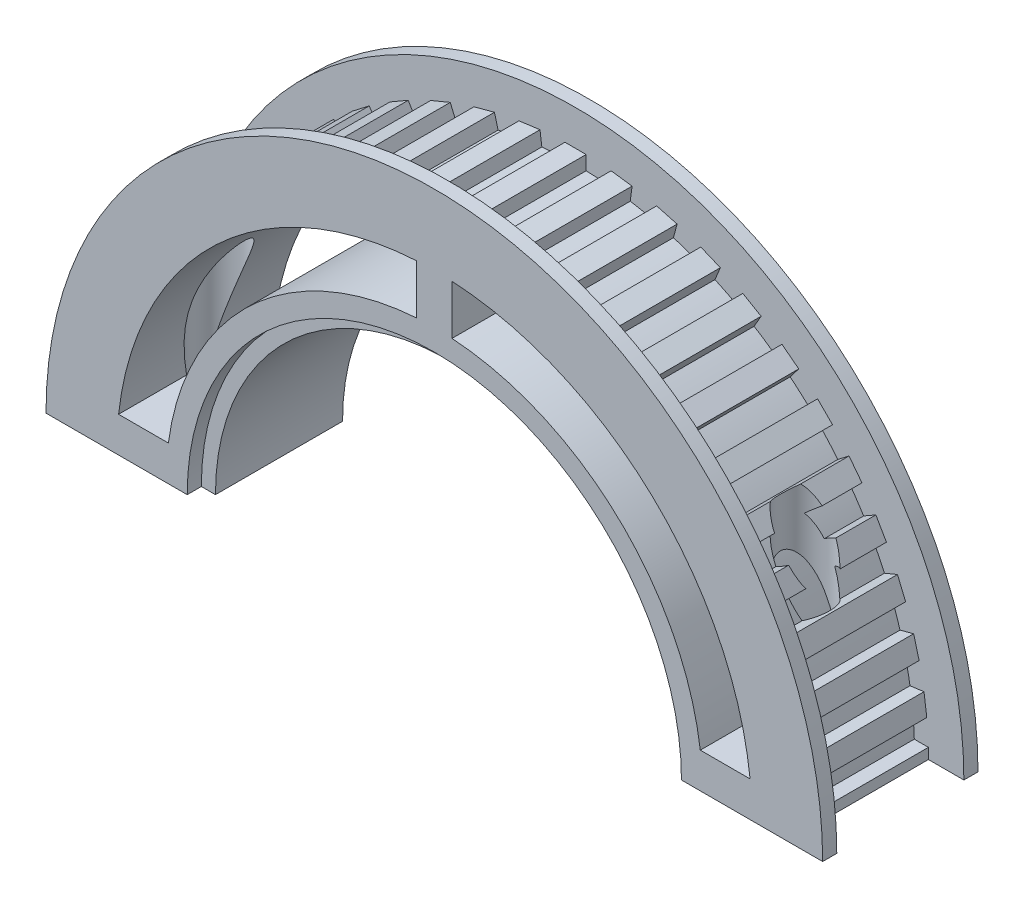
from build123d import *

# Parameters (mm, degrees)
BOSS_EXTRUDE1_DEPTH = 22
SKETCH10_R          = 1.75
CUT_EXTRUDE4_DEPTH  = 75.022378064
BOSS_EXTRUDE3_DEPTH = 2
BOSS_EXTRUDE4_START = -2
BOSS_EXTRUDE4_DEPTH = 2
BOSS_EXTRUDE5_DEPTH = 18
SKETCH11_R          = 3.5
CUT_EXTRUDE5_DEPTH  = 78.517739934
CUT_EXTRUDE6_DEPTH  = 2


with BuildPart() as part:
    # Sketch1 → Boss-Extrude1 (new body)
    with BuildSketch(Plane.XY):
        with BuildLine():
            Line((35, 0), (49.976556775, 0))
            Line((49.976556775, 0), (49.976556775, 1.5))
            Line((49.976556775, 1.5), (47.976556775, 1.5))
            ThreePointArc((47.976556775, 1.5), (47.897228315, 3.139350203), (47.761899969, 4.77502998))
            Line((47.761899969, 4.77502998), (49.744789692, 5.036082364))
            Line((49.744789692, 5.036082364), (49.353211116, 8.010416948))
            Line((49.353211116, 8.010416948), (47.370321393, 7.749364564))
            ThreePointArc((47.370321393, 7.749364564), (47.077693459, 9.364335457), (46.730023813, 10.968357872))
            Line((46.730023813, 10.968357872), (48.661875466, 11.485995963))
            Line((48.661875466, 11.485995963), (47.88541833, 14.383773441))
            Line((47.88541833, 14.383773441), (45.953566678, 13.866135351))
            ThreePointArc((45.953566678, 13.866135351), (45.452646216, 15.429094335), (44.898583993, 16.974014121))
            Line((44.898583993, 16.974014121), (46.746343059, 17.739380986))
            Line((46.746343059, 17.739380986), (45.598292761, 20.511019583))
            Line((45.598292761, 20.511019583), (43.750533696, 19.745652719))
            ThreePointArc((43.750533696, 19.745652719), (43.049891594, 21.229857131), (42.298916953, 22.689240282))
            Line((42.298916953, 22.689240282), (44.030967761, 23.689240282))
            Line((44.030967761, 23.689240282), (42.530967761, 26.287316493))
            Line((42.530967761, 26.287316493), (40.798916953, 25.287316493))
            ThreePointArc((40.798916953, 25.287316493), (39.910541391, 26.667371185), (38.975503717, 28.016247251))
            Line((38.975503717, 28.016247251), (40.562210397, 29.233770109))
            Line((40.562210397, 29.233770109), (38.73592611, 31.61383013))
            Line((38.73592611, 31.61383013), (37.14921943, 30.396307272))
            ThreePointArc((37.14921943, 30.396307272), (36.088310759, 31.648599125), (34.985208805, 32.863888462))
            Line((34.985208805, 32.863888462), (36.399422368, 34.278102024))
            Line((36.399422368, 34.278102024), (34.278102024, 36.399422368))
            Line((34.278102024, 36.399422368), (32.863888462, 34.985208805))
            ThreePointArc((32.863888462, 34.985208805), (31.648599125, 36.088310759), (30.396307272, 37.14921943))
            Line((30.396307272, 37.14921943), (31.61383013, 38.73592611))
            Line((31.61383013, 38.73592611), (29.233770109, 40.562210397))
            Line((29.233770109, 40.562210397), (28.016247251, 38.975503717))
            ThreePointArc((28.016247251, 38.975503717), (26.667371185, 39.910541391), (25.287316493, 40.798916953))
            Line((25.287316493, 40.798916953), (26.287316493, 42.530967761))
            Line((26.287316493, 42.530967761), (23.689240282, 44.030967761))
            Line((23.689240282, 44.030967761), (22.689240282, 42.298916953))
            ThreePointArc((22.689240282, 42.298916953), (21.229857131, 43.049891594), (19.745652719, 43.750533696))
            Line((19.745652719, 43.750533696), (20.511019583, 45.598292761))
            Line((20.511019583, 45.598292761), (17.739380986, 46.746343059))
            Line((17.739380986, 46.746343059), (16.974014121, 44.898583993))
            ThreePointArc((16.974014121, 44.898583993), (15.429094335, 45.452646216), (13.866135351, 45.953566678))
            Line((13.866135351, 45.953566678), (14.383773441, 47.88541833))
            Line((14.383773441, 47.88541833), (11.485995963, 48.661875466))
            Line((11.485995963, 48.661875466), (10.968357872, 46.730023813))
            ThreePointArc((10.968357872, 46.730023813), (9.364335457, 47.077693459), (7.749364564, 47.370321393))
            Line((7.749364564, 47.370321393), (8.010416948, 49.353211116))
            Line((8.010416948, 49.353211116), (5.036082364, 49.744789692))
            Line((5.036082364, 49.744789692), (4.77502998, 47.761899969))
            ThreePointArc((4.77502998, 47.761899969), (3.139350203, 47.897228315), (1.5, 47.976556775))
            Line((1.5, 47.976556775), (1.5, 49.976556775))
            Line((1.5, 49.976556775), (-1.5, 49.976556775))
            Line((-1.5, 49.976556775), (-1.5, 47.976556775))
            ThreePointArc((-1.5, 47.976556775), (-3.139350203, 47.897228315), (-4.77502998, 47.761899969))
            Line((-4.77502998, 47.761899969), (-5.036082364, 49.744789692))
            Line((-5.036082364, 49.744789692), (-8.010416948, 49.353211116))
            Line((-8.010416948, 49.353211116), (-7.749364564, 47.370321393))
            ThreePointArc((-7.749364564, 47.370321393), (-9.364335457, 47.077693459), (-10.968357872, 46.730023813))
            Line((-10.968357872, 46.730023813), (-11.485995963, 48.661875466))
            Line((-11.485995963, 48.661875466), (-14.383773441, 47.88541833))
            Line((-14.383773441, 47.88541833), (-13.866135351, 45.953566678))
            ThreePointArc((-13.866135351, 45.953566678), (-15.429094335, 45.452646216), (-16.974014121, 44.898583993))
            Line((-16.974014121, 44.898583993), (-17.739380986, 46.746343059))
            Line((-17.739380986, 46.746343059), (-20.511019583, 45.598292761))
            Line((-20.511019583, 45.598292761), (-19.745652719, 43.750533696))
            ThreePointArc((-19.745652719, 43.750533696), (-21.229857131, 43.049891594), (-22.689240282, 42.298916953))
            Line((-22.689240282, 42.298916953), (-23.689240282, 44.030967761))
            Line((-23.689240282, 44.030967761), (-26.287316493, 42.530967761))
            Line((-26.287316493, 42.530967761), (-25.287316493, 40.798916953))
            ThreePointArc((-25.287316493, 40.798916953), (-26.667371185, 39.910541391), (-28.016247251, 38.975503717))
            Line((-28.016247251, 38.975503717), (-29.233770109, 40.562210397))
            Line((-29.233770109, 40.562210397), (-31.61383013, 38.73592611))
            Line((-31.61383013, 38.73592611), (-30.396307272, 37.14921943))
            ThreePointArc((-30.396307272, 37.14921943), (-31.648599125, 36.088310759), (-32.863888462, 34.985208805))
            Line((-32.863888462, 34.985208805), (-34.278102024, 36.399422368))
            Line((-34.278102024, 36.399422368), (-36.399422368, 34.278102024))
            Line((-36.399422368, 34.278102024), (-34.985208805, 32.863888462))
            ThreePointArc((-34.985208805, 32.863888462), (-36.088310759, 31.648599125), (-37.14921943, 30.396307272))
            Line((-37.14921943, 30.396307272), (-38.73592611, 31.61383013))
            Line((-38.73592611, 31.61383013), (-40.562210397, 29.233770109))
            Line((-40.562210397, 29.233770109), (-38.975503717, 28.016247251))
            ThreePointArc((-38.975503717, 28.016247251), (-39.910541391, 26.667371185), (-40.798916953, 25.287316493))
            Line((-40.798916953, 25.287316493), (-42.530967761, 26.287316493))
            Line((-42.530967761, 26.287316493), (-44.030967761, 23.689240282))
            Line((-44.030967761, 23.689240282), (-42.298916953, 22.689240282))
            ThreePointArc((-42.298916953, 22.689240282), (-43.049891594, 21.229857131), (-43.750533696, 19.745652719))
            Line((-43.750533696, 19.745652719), (-45.598292761, 20.511019583))
            Line((-45.598292761, 20.511019583), (-46.746343059, 17.739380986))
            Line((-46.746343059, 17.739380986), (-44.898583993, 16.974014121))
            ThreePointArc((-44.898583993, 16.974014121), (-45.452646216, 15.429094335), (-45.953566678, 13.866135351))
            Line((-45.953566678, 13.866135351), (-47.88541833, 14.383773441))
            Line((-47.88541833, 14.383773441), (-48.661875466, 11.485995963))
            Line((-48.661875466, 11.485995963), (-46.730023813, 10.968357872))
            ThreePointArc((-46.730023813, 10.968357872), (-47.077693459, 9.364335457), (-47.370321393, 7.749364564))
            Line((-47.370321393, 7.749364564), (-49.353211116, 8.010416948))
            Line((-49.353211116, 8.010416948), (-49.744789692, 5.036082364))
            Line((-49.744789692, 5.036082364), (-47.761899969, 4.77502998))
            ThreePointArc((-47.761899969, 4.77502998), (-47.897228315, 3.139350203), (-47.976556775, 1.5))
            Line((-47.976556775, 1.5), (-49.976556775, 1.5))
            Line((-49.976556775, 1.5), (-49.976556775, 0))
            Line((-49.976556775, 0), (-35, 0))
            ThreePointArc((-35, 0), (0, 35), (35, 0))
        make_face()
        with BuildLine():
            Line((-37.669616404, 5), (-44.72135955, 5))
            ThreePointArc((-44.72135955, 5), (-30.920469672, 32.694411683), (-2.5, 44.930501889))
            Line((-2.5, 44.930501889), (-2.5, 37.917673979))
            ThreePointArc((-2.5, 37.917673979), (-25.967149161, 27.743596819), (-37.669616404, 5))
        make_face(mode=Mode.SUBTRACT)
        with BuildLine():
            ThreePointArc((2.5, 44.930501889), (30.920469672, 32.694411683), (44.72135955, 5))
            Line((44.72135955, 5), (37.669616404, 5))
            ThreePointArc((37.669616404, 5), (25.967149161, 27.743596819), (2.5, 37.917673979))
            Line((2.5, 37.917673979), (2.5, 44.930501889))
        make_face(mode=Mode.SUBTRACT)
    extrude(amount=BOSS_EXTRUDE1_DEPTH)

    # Sketch10 → Cut-Extrude4 (cut, through all)
    with BuildSketch(Plane(origin=(0, 0, 0), x_dir=(-1, 0, 0), z_dir=(0, -1, 0))):
        with Locations(Location((41.5, -11, 0), (0, 0, 90))):
            Circle(SKETCH10_R)
    cut_extrude4 = extrude(amount=-CUT_EXTRUDE4_DEPTH, mode=Mode.SUBTRACT)

    # Mirror4: Cut-Extrude4 across plane
    add(cut_extrude4.mirror(Plane(origin=(0, 0, 0), x_dir=(0, 0, 1), z_dir=(1, 0, 0))), mode=Mode.SUBTRACT)

    # Sketch5 → Boss-Extrude3 (add)
    with BuildSketch(Plane.XY):
        with BuildLine():
            Line((-48, 0), (-55, 0))
            ThreePointArc((-55, 0), (0, 55), (55, 0))
            Line((55, 0), (48, 0))
            ThreePointArc((48, 0), (0, 48), (-48, 0))
        make_face()
    extrude(amount=BOSS_EXTRUDE3_DEPTH)

    # Sketch6 → Boss-Extrude4 (add)
    with BuildSketch(Plane.XY.offset(22).offset(BOSS_EXTRUDE4_START)):
        with BuildLine():
            Line((-45, 0), (-55, 0))
            ThreePointArc((-55, 0), (0, 55), (55, 0))
            Line((55, 0), (45, 0))
            ThreePointArc((45, 0), (0, 45), (-45, 0))
        make_face()
    extrude(amount=BOSS_EXTRUDE4_DEPTH)

    # Sketch7 → Boss-Extrude5 (add)
    with BuildSketch(Plane.XY.offset(2)):
        with BuildLine():
            Line((-35, 0), (-33, 0))
            ThreePointArc((-33, 0), (0, 33), (33, 0))
            Line((33, 0), (35, 0))
            ThreePointArc((35, 0), (0, 35), (-35, 0))
        make_face()
    extrude(amount=BOSS_EXTRUDE5_DEPTH)

    # Sketch11 → Cut-Extrude5 (cut, through all)
    with BuildSketch(Plane(origin=(0, 5, 0), x_dir=(1, 0, 0), z_dir=(0, 1, 0))):
        with Locations(Location((-41.5, -11, 0), (0, 0, 78.44494507))):
            Circle(SKETCH11_R)
    cut_extrude5 = extrude(amount=CUT_EXTRUDE5_DEPTH, mode=Mode.SUBTRACT)

    # Mirror5: Cut-Extrude5 across plane
    add(cut_extrude5.mirror(Plane(origin=(0, 0, 0), x_dir=(0, 0, 1), z_dir=(1, 0, 0))), mode=Mode.SUBTRACT)

    # Sketch12 → Cut-Extrude6 (cut)
    with BuildSketch(Plane(origin=(0, 5, 0), x_dir=(1, 0, 0), z_dir=(0, 1, 0))):
        Polygon((-41.5, -14.175426481), (-38.75, -12.58771324), (-38.75, -9.41228676), (-41.5, -7.824573519), (-44.25, -9.41228676), (-44.25, -12.58771324), align=None)
    extrude(amount=-CUT_EXTRUDE6_DEPTH, mode=Mode.SUBTRACT)


solid = part.part
